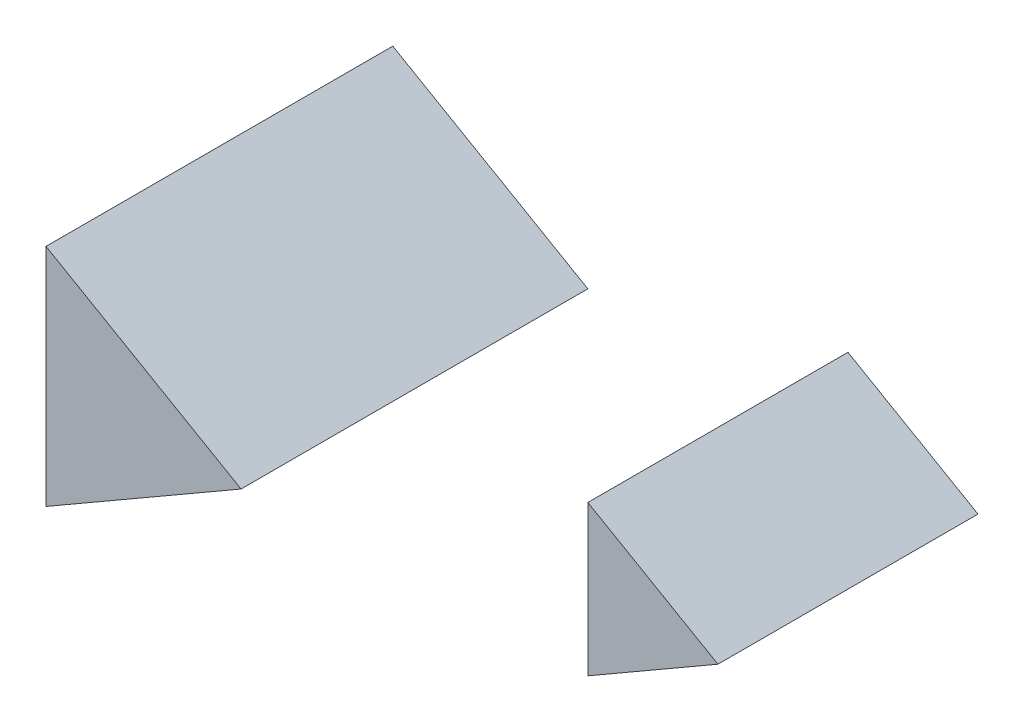
from build123d import *

# Parameters (mm, degrees)
EXTRUDE_1_DEPTH = 800
EXTRUDE_2_DEPTH = 600


with BuildPart() as part:
    # 草图1 → 凸台-拉伸1 (new body)
    with BuildSketch(Plane.XY):
        Polygon((-200, 0), (-650, 259.807621135), (-650, -259.807621135), align=None)
    extrude(amount=EXTRUDE_1_DEPTH)


with BuildPart() as body_2:
    # 草图2 → 凸台-拉伸2 (new body)
    with BuildSketch(Plane.XY):
        Polygon((700, 0), (400, 173.205080757), (400, -173.205080757), align=None)
    extrude(amount=EXTRUDE_2_DEPTH)


solid = Compound([part.part, body_2.part])
